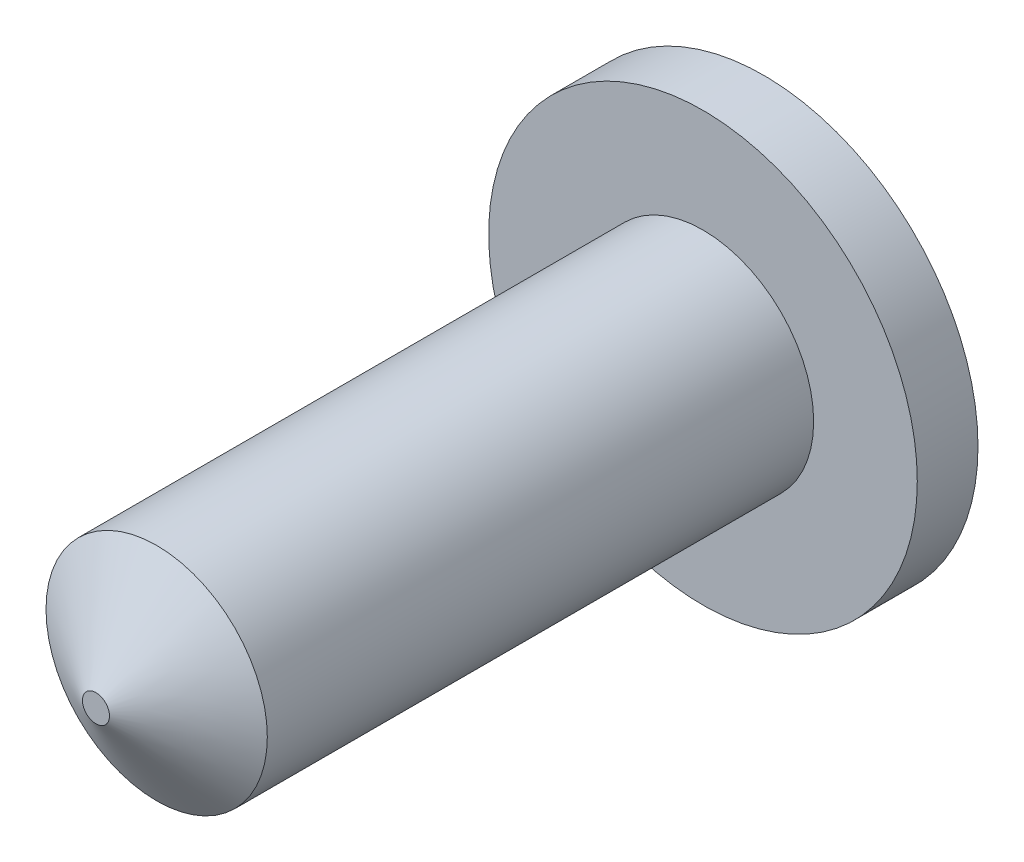
from build123d import *

# Parameters (mm, degrees)
SKETCH1_R           = 35.304197416
BOSS_EXTRUDE1_DEPTH = 10
SKETCH2_R           = 18.229259508
BOSS_EXTRUDE2_DEPTH = 100
CHAMFER1_SIZE       = 10
CHAMFER1_SIZE2      = 16.00334529


with BuildPart() as part:
    # Sketch1 → Boss-Extrude1 (new body)
    with BuildSketch(Plane.XY):
        Circle(SKETCH1_R)
    extrude(amount=BOSS_EXTRUDE1_DEPTH)

    # Sketch2 → Boss-Extrude2 (add)
    with BuildSketch(Plane.XY.offset(10)):
        with Locations(Location((0, 0, 0), (0, 0, 180))):
            Circle(SKETCH2_R)
    extrude(amount=BOSS_EXTRUDE2_DEPTH)

    # Chamfer1
    chamfer1_edges = [part.edges().sort_by_distance(p)[0] for p in [
        (18.229259508, 0, 110),
    ]]
    chamfer1_side = [part.faces().sort_by_distance(p)[0] for p in [
        (18.229259508, 0, 60),
    ]]
    chamfer(chamfer1_edges, length=CHAMFER1_SIZE, length2=CHAMFER1_SIZE2, reference=chamfer1_side[0])


solid = part.part
